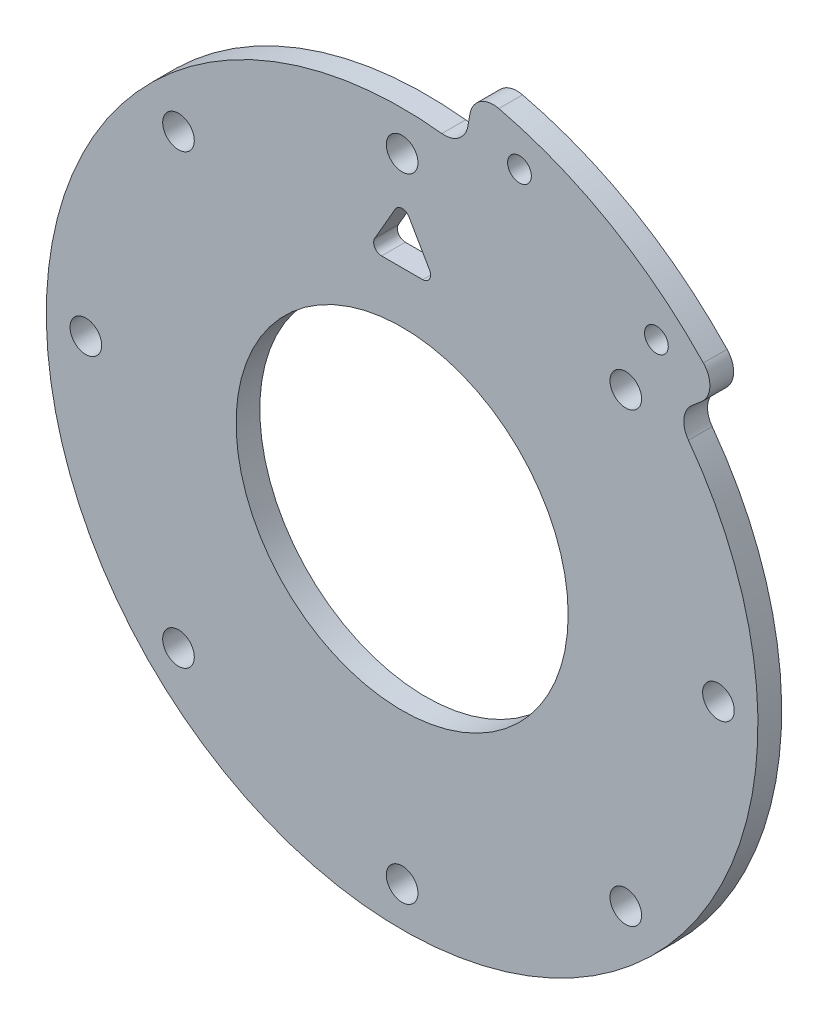
from build123d import *

# Parameters (mm, degrees)
SKETCH_1_R          = 45
SKETCH_1_R_2        = 21
EXTRUDE_1_DEPTH     = 3
SKETCH_2_R          = 2
CUT_EXTRUDE_1_DEPTH = 10
CUT_EXTRUDE_2_DEPTH = 3
EXTRUDE_START       = -3
SKETCH_3_R          = 1.5
EXTRUDE_3_DEPTH     = 3
FILLET_2_R          = 1
FILLET_3_R          = 3


with BuildPart() as part:
    # 草图1 → 凸台-拉伸1 (new body)
    with BuildSketch(Plane.XY):
        Circle(SKETCH_1_R)
        Circle(SKETCH_1_R_2, mode=Mode.SUBTRACT)
    extrude(amount=EXTRUDE_1_DEPTH)

    # 草图2 → 切除-拉伸1 (cut)
    with BuildSketch(Plane.XY.offset(3)):
        with Locations((0, 40)):
            Circle(SKETCH_2_R)
        with Locations((28.284271247, 28.284271247)):
            Circle(SKETCH_2_R)
        with Locations((40, 0)):
            Circle(SKETCH_2_R)
        with Locations((28.284271247, -28.284271247)):
            Circle(SKETCH_2_R)
        with Locations((0, -40)):
            Circle(SKETCH_2_R)
        with Locations((-28.284271247, -28.284271247)):
            Circle(SKETCH_2_R)
        with Locations((-40, 0)):
            Circle(SKETCH_2_R)
        with Locations((-28.284271247, 28.284271247)):
            Circle(SKETCH_2_R)
    extrude(amount=-CUT_EXTRUDE_1_DEPTH, mode=Mode.SUBTRACT)

    # 草图4 → 切除-拉伸2 (cut)
    with BuildSketch(Plane.XY.offset(3)):
        Polygon((4.330127019, 27.5), (0, 35), (-4.330127019, 27.5), align=None)
    extrude(amount=-CUT_EXTRUDE_2_DEPTH, mode=Mode.SUBTRACT)

    # 草图3 → 凸台-拉伸3 (add)
    with BuildSketch(Plane.XY.offset(3).offset(EXTRUDE_START)):
        with BuildLine():
            Line((9.116529328, 51.702407033), (7.814167995, 44.316348886))
            ThreePointArc((7.814167995, 44.316348886), (22.5, 38.97114317), (34.47199994, 28.925442436))
            Line((34.47199994, 28.925442436), (40.217333264, 33.746349509))
            ThreePointArc((40.217333264, 33.746349509), (26.25, 45.466333699), (9.116529328, 51.702407033))
        make_face()
        with Locations((32.160254038, 35.703193978)):
            Circle(SKETCH_3_R, mode=Mode.SUBTRACT)
        with Locations((14.839745962, 45.703193978)):
            Circle(SKETCH_3_R, mode=Mode.SUBTRACT)
    extrude(amount=EXTRUDE_3_DEPTH)

    # 圆角2
    fillet_2_edges = [part.edges().sort_by_distance(p)[0] for p in [
        (4.330127019, 27.5, 1.5),
        (-4.330127019, 27.5, 1.5),
        (0, 35, 1.5),
    ]]
    fillet(fillet_2_edges, radius=FILLET_2_R)

    # 圆角3
    fillet_3_edges = [part.edges().sort_by_distance(p)[0] for p in [
        (40.217333264, 33.746349509, 1.5),
        (34.47199994, 28.925442436, 1.5),
        (7.814167995, 44.316348886, 1.5),
        (9.116529328, 51.702407033, 1.5),
    ]]
    fillet(fillet_3_edges, radius=FILLET_3_R)


solid = part.part
